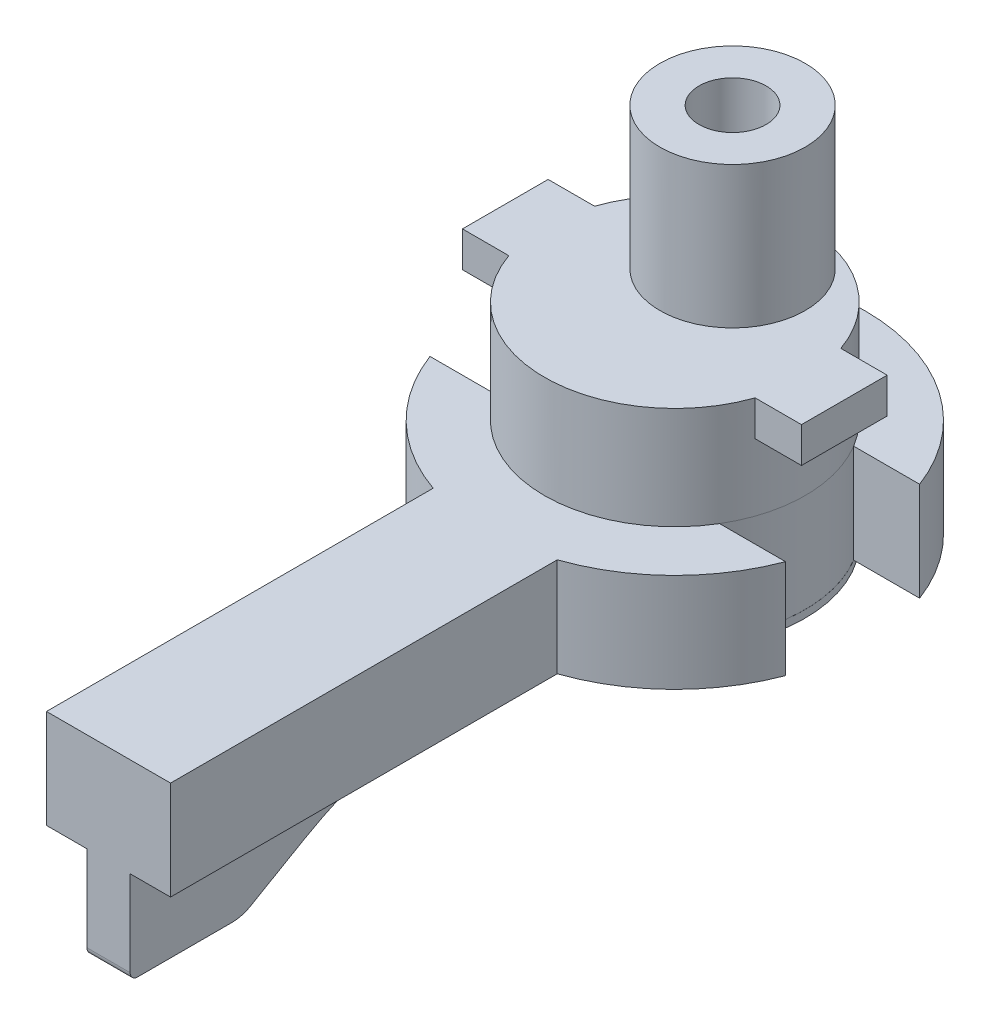
from build123d import *

# Parameters (mm, degrees)
CROQUIS1_R                   = 5.1
SALIENTE_EXTRUIR2_DEPTH      = 2.85
CROQUIS4_R                   = 3.5
SALIENTE_EXTRUIR3_DEPTH      = 2.75
CROQUIS5_R                   = 1.95
SALIENTE_EXTRUIR4_DEPTH      = 3.8
SALIENTE_EXTRUIR5_DEPTH      = 15.2
CORTAR_EXTRUIR4_REACH        = 21.109
CROQUIS8_W                   = 1.085
CROQUIS8_H                   = 2.3
CORTAR_EXTRUIR6_DEPTH        = 10.2
REDONDEO1_R                  = 1
REDONDEO2_R                  = 10
CORTAR_EXTRUIR7_DEPTH        = 0.2
CROQUIS13_R                  = 2.5
CORTAR_EXTRUIR8_DEPTH        = 3.2
CROQUIS14_R                  = 0.9
CORTAR_EXTRUIR9_DEPTH        = 3.7
CORTAR_EXTRUIR10_DEPTH       = 2.65
REDONDEO3_R                  = 0.2
SALIENTE_EXTRUIR6_DEPTH      = 4.55
SALIENTE_EXTRUIR6_DEPTH_BACK = 4.55


with BuildPart() as part:
    # Croquis1 → Saliente-Extruir2 (new body)
    with BuildSketch(Plane(origin=(0, 0, 0), x_dir=(1, 0, 0), z_dir=(0, 1, 0))):
        with Locations(Location((0, 0, 0), (0, 0, 270))):
            Circle(CROQUIS1_R)
    extrude(amount=SALIENTE_EXTRUIR2_DEPTH)

    # Croquis4 → Saliente-Extruir3 (add)
    with BuildSketch(Plane(origin=(0, 2.85, 0), x_dir=(1, 0, 0), z_dir=(0, 1, 0))):
        with Locations(Location((0, 0, 0), (0, 0, 270))):
            Circle(CROQUIS4_R)
    extrude(amount=SALIENTE_EXTRUIR3_DEPTH)

    # Croquis5 → Saliente-Extruir4 (add)
    with BuildSketch(Plane(origin=(0, 5.6, 0), x_dir=(1, 0, 0), z_dir=(0, 1, 0))):
        with Locations(Location((0, 1.55, 0), (0, 0, 89.999128056))):
            Circle(CROQUIS5_R)
    extrude(amount=SALIENTE_EXTRUIR4_DEPTH)

    # Croquis7 → Saliente-Extruir5 (add)
    with BuildSketch(Plane.XY):
        Polygon((0, 2.85), (1.665, 2.85), (1.665, -2.3), (-1.665, -2.3), (-1.665, 2.85), align=None)
    extrude(amount=SALIENTE_EXTRUIR5_DEPTH)

    # Croquis11 → Cortar-Extruir4 (cut, up to next)
    with BuildSketch(Plane(origin=(1.665, 0, 0), x_dir=(0, 0, -1), z_dir=(1, 0, 0)), mode=Mode.PRIVATE) as cortar_extruir4_sk1:
        Polygon((-0.217533037, -2.3), (0, -2.3), (0, 0), (-4.82055754, 0), (-8.216283143, 0), (-12.2, -2.3), align=None)
    cortar_extruir4_tool1 = extrude(cortar_extruir4_sk1.sketch, amount=-CORTAR_EXTRUIR4_REACH, mode=Mode.PRIVATE) & part.part
    add(cortar_extruir4_tool1.solids().sort_by_distance((1.665, -1.224798, 5.168848))[0], mode=Mode.SUBTRACT)

    # Croquis8 → Cortar-Extruir6 (cut)
    with BuildSketch(Plane.XY.offset(15.2)):
        with Locations((-1.1225, -1.15)):
            Rectangle(CROQUIS8_W, CROQUIS8_H)
        with Locations((1.1225, -1.15)):
            Rectangle(CROQUIS8_W, CROQUIS8_H)
    extrude(amount=-CORTAR_EXTRUIR6_DEPTH, mode=Mode.SUBTRACT)

    # Redondeo1
    redondeo1_edges = [part.edges().sort_by_distance(p)[0] for p in [
        (0, -2.3, 12.2),
    ]]
    fillet(redondeo1_edges, radius=REDONDEO1_R)

    # Redondeo2
    redondeo2_edges = [part.edges().sort_by_distance(p)[0] for p in [
        (0, 0, 8.216283143),
    ]]
    fillet(redondeo2_edges, radius=REDONDEO2_R)

    # Croquis12 → Cortar-Extruir7 (cut)
    with BuildSketch(Plane.XZ):
        with BuildLine():
            Line((-0.58, 15.2), (-1.665, 15.2))
            Line((-1.665, 15.2), (-1.665, 4.82055754))
            ThreePointArc((-1.665, 4.82055754), (0, -5.1), (1.665, 4.82055754))
            Line((1.665, 4.82055754), (1.665, 15.2))
            Line((1.665, 15.2), (0.58, 15.2))
            Line((0.58, 15.2), (0.58, 5.536791218))
            Line((0.58, 5.536791218), (0.58, 3.451608321))
            ThreePointArc((0.58, 3.451608321), (0, -3.5), (-0.58, 3.451608321))
            Line((-0.58, 3.451608321), (-0.58, 5.536791218))
            Line((-0.58, 5.536791218), (-0.58, 15.2))
        make_face()
    extrude(amount=-CORTAR_EXTRUIR7_DEPTH, mode=Mode.SUBTRACT)

    # Croquis13 → Cortar-Extruir8 (cut)
    with BuildSketch(Plane.XZ):
        with Locations(Location((0, 0, 0), (0, 0, 270))):
            Circle(CROQUIS13_R)
    extrude(amount=-CORTAR_EXTRUIR8_DEPTH, mode=Mode.SUBTRACT)

    # Croquis14 → Cortar-Extruir9 (cut)
    with BuildSketch(Plane(origin=(0, 9.4, 0), x_dir=(1, 0, 0), z_dir=(0, 1, 0))):
        with Locations(Location((0, 1.55, 0), (0, 0, 270))):
            Circle(CROQUIS14_R)
    extrude(amount=-CORTAR_EXTRUIR9_DEPTH, mode=Mode.SUBTRACT)

    # Croquis15 → Cortar-Extruir10 (cut)
    with BuildSketch(Plane.XZ.offset(-0.2)):
        with BuildLine():
            Line((-4.771792116, 1.8), (-2.999613342, 1.8))
            ThreePointArc((-2.999613342, 1.8), (-3.498239586, 0), (-2.999613342, -1.8))
            Line((-2.999613342, -1.8), (-4.771792116, -1.8))
            ThreePointArc((-4.771792116, -1.8), (-5.1, 0), (-4.771792116, 1.8))
        make_face()
        with BuildLine():
            Line((4.771792116, -1.8), (2.999613342, -1.8))
            ThreePointArc((2.999613342, -1.8), (3.498239586, 0), (2.999613342, 1.8))
            Line((2.999613342, 1.8), (4.771792116, 1.8))
            ThreePointArc((4.771792116, 1.8), (5.1, 0), (4.771792116, -1.8))
        make_face()
    extrude(amount=-CORTAR_EXTRUIR10_DEPTH, mode=Mode.SUBTRACT)

    # Redondeo3
    redondeo3_edges = [part.edges().sort_by_distance(p)[0] for p in [
        (0, -2.3, 15.2),
    ]]
    fillet(redondeo3_edges, radius=REDONDEO3_R)

    # Croquis16 → Saliente-Extruir6 (add, two sides: drawn at the far end of the back side and taken through both)
    with BuildSketch(Plane(origin=(0, 0, 0), x_dir=(0, 0, -1), z_dir=(1, 0, 0)).offset(-SALIENTE_EXTRUIR6_DEPTH_BACK)):
        Polygon((0, 5.6), (1.15, 5.6), (1.15, 4.65), (-1.15, 4.65), (-1.15, 5.6), align=None)
    extrude(amount=SALIENTE_EXTRUIR6_DEPTH + SALIENTE_EXTRUIR6_DEPTH_BACK)


solid = part.part
